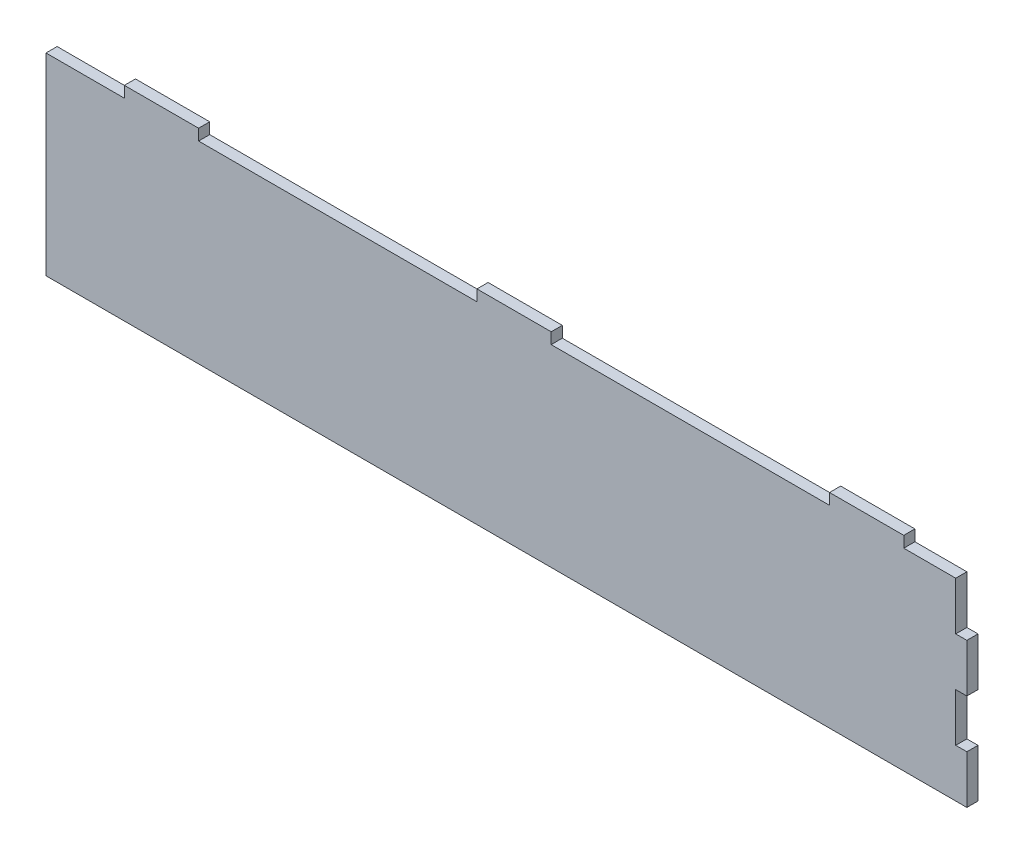
from build123d import *

# Parameters (mm, degrees)
BOSS_EXTRUDE1_DEPTH = 3


with BuildPart() as part:
    # Sketch1 → Boss-Extrude1 (new body)
    with BuildSketch(Plane.XY):
        Polygon((-124.555002656, 24.536375762), (-103.445002656, 24.536375762), (-103.445002656, 27.536375762), (-83.445002656, 27.536375762), (-83.445002656, 24.536375762), (-8.445002656, 24.536375762), (-8.445002656, 27.536375762), (11.554997344, 27.536375762), (11.554997344, 24.536375762), (86.554997344, 24.536375762), (86.554997344, 27.536375762), (106.554997344, 27.536375762), (106.554997344, 24.536375762), (120.554997344, 24.536375762), (120.554997344, 11.536375762), (123.554997344, 11.536375762), (123.554997344, -1.463624238), (120.554997344, -1.463624238), (120.554997344, -14.463624238), (123.554997344, -14.463624238), (123.554997344, -27.463624238), (-124.555002656, -27.463624238), align=None)
    extrude(amount=BOSS_EXTRUDE1_DEPTH)


solid = part.part
